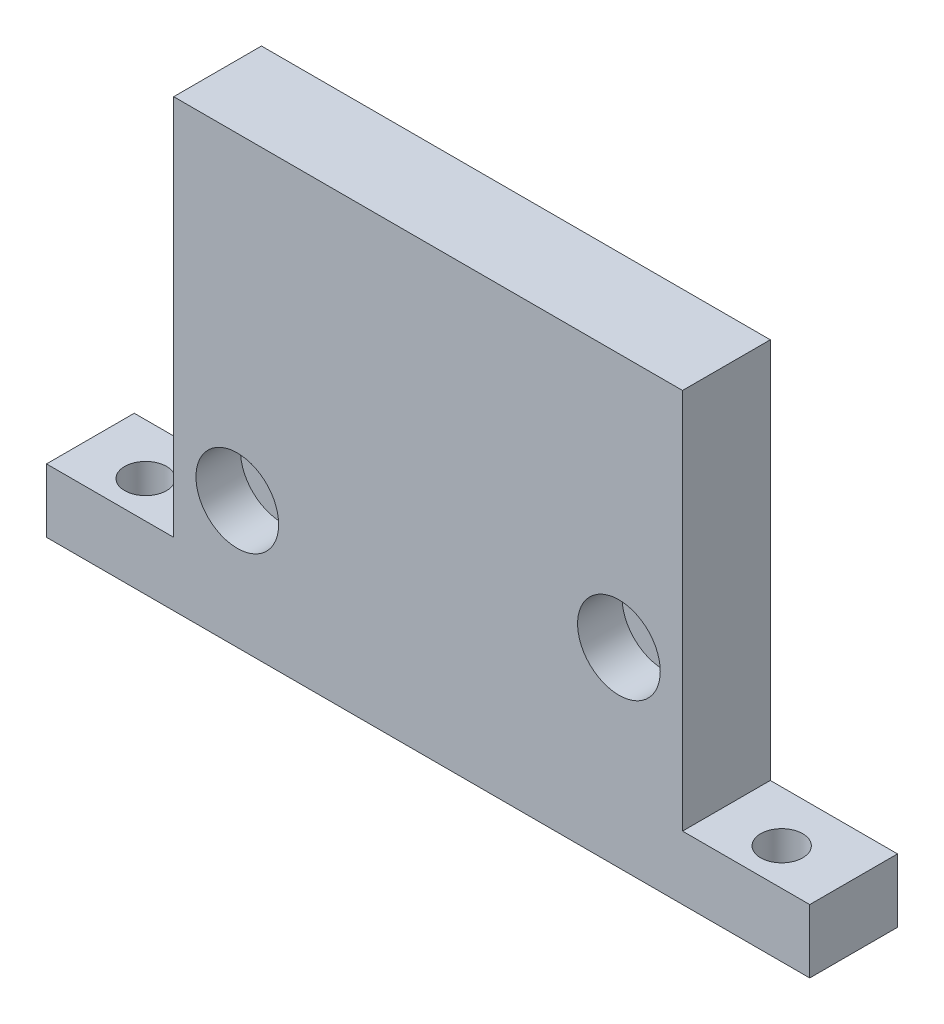
from build123d import *

# Parameters (mm, degrees)
SKETCH_1_W          = 60
SKETCH_1_H          = 6.9
EXTRUDE_1_DEPTH     = 5
SKETCH_2_R          = 1.65
CUT_EXTRUDE_1_DEPTH = 10
SKETCH_3_W          = 40
SKETCH_3_H          = 6.9
EXTRUDE_2_DEPTH     = 30
SKETCH_5_R          = 1.65
CUT_EXTRUDE_2_DEPTH = 25
CUT_EXTRUDE_START   = -3.5
SKETCH_6_R          = 3.25
SKETCH_6_R_2        = 1.65
CUT_EXTRUDE_3_DEPTH = 3.5


with BuildPart() as part:
    # 草图1 → 凸台-拉伸1 (new body)
    with BuildSketch(Plane(origin=(0, 0, 0), x_dir=(1, 0, 0), z_dir=(0, 1, 0))):
        with Locations((-12.970884588, 1.077948994)):
            Rectangle(SKETCH_1_W, SKETCH_1_H)
    extrude(amount=EXTRUDE_1_DEPTH)

    # 草图2 → 切除-拉伸1 (cut)
    with BuildSketch(Plane.XZ):
        with Locations(Location((11.923103363, -0.527948994, 0), (0, 0, 270))):
            Circle(SKETCH_2_R)
        with Locations(Location((-38.076896637, -0.527948994, 0), (0, 0, 270))):
            Circle(SKETCH_2_R)
    extrude(amount=-CUT_EXTRUDE_1_DEPTH, mode=Mode.SUBTRACT)

    # 草图3 → 凸台-拉伸2 (add)
    with BuildSketch(Plane(origin=(0, 5, 0), x_dir=(1, 0, 0), z_dir=(0, 1, 0))):
        with Locations((-12.970884588, 1.077948994)):
            Rectangle(SKETCH_3_W, SKETCH_3_H)
    extrude(amount=EXTRUDE_2_DEPTH)

    # 草图5 → 切除-拉伸2 (cut)
    with BuildSketch(Plane(origin=(0, 0, -4.527948994), x_dir=(-1, 0, 0), z_dir=(0, 0, -1))):
        with Locations((27.970884588, 10)):
            Circle(SKETCH_5_R)
        with Locations((-2.029115412, 15)):
            Circle(SKETCH_5_R)
    extrude(amount=-CUT_EXTRUDE_2_DEPTH, mode=Mode.SUBTRACT)

    # 草图6 → 切除-拉伸3 (cut)
    # profile 1 of 2: a face of its own
    with BuildSketch(Plane.XY.offset(2.372051006).offset(CUT_EXTRUDE_START)):
        with Locations((-27.970884588, 10)):
            Circle(SKETCH_6_R)
        with Locations(Location((-27.970884588, 10, 0), (0, 0, 180))):
            Circle(SKETCH_6_R_2, mode=Mode.SUBTRACT)
    # profile 2 of 2: a face of its own
    with BuildSketch(Plane.XY.offset(2.372051006).offset(CUT_EXTRUDE_START)):
        with Locations((2.029115412, 15)):
            Circle(SKETCH_6_R)
        with Locations(Location((2.029115412, 15, 0), (0, 0, 180))):
            Circle(SKETCH_6_R_2, mode=Mode.SUBTRACT)
    extrude(amount=CUT_EXTRUDE_3_DEPTH, mode=Mode.SUBTRACT)


solid = part.part
